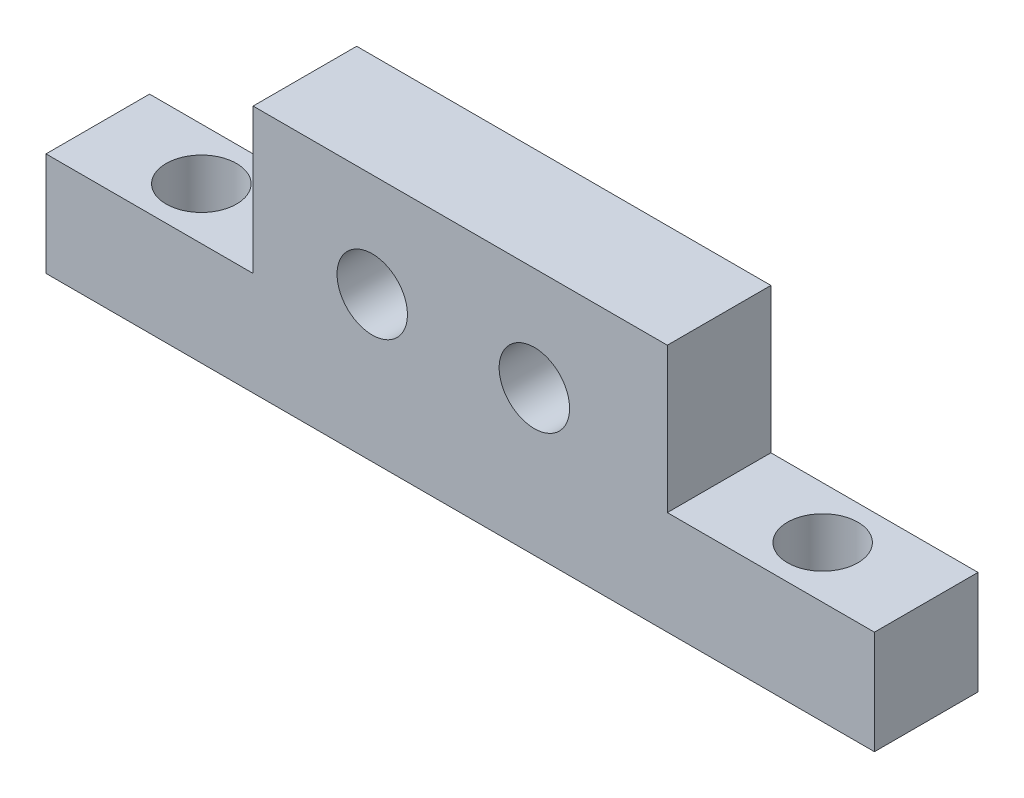
from build123d import *

# Parameters (mm, degrees)
BOSS_EXTRUDE1_DEPTH = 5
D_GAGEMENT_M31_D    = 3.4
D_GAGEMENT_M32_D    = 3.4


with BuildPart() as part:
    # Sketch1 → Boss-Extrude1 (new body)
    with BuildSketch(Plane.XY):
        Polygon((10, -3.5), (20, -3.5), (20, -8.5), (-20, -8.5), (-20, -3.5), (-10, -3.5), (-10, 3.5), (10, 3.5), align=None)
    extrude(amount=BOSS_EXTRUDE1_DEPTH)

    # Dégagement M31 (through all)
    with Locations(Plane.XY.offset(5)):
        with Locations((3.580019281, -1.5), (-4.248289546, -1.5)):
            Hole(D_GAGEMENT_M31_D / 2)

    # Dégagement M32 (through all)
    with Locations(Plane(origin=(0, -3.5, 0), x_dir=(1, 0, 0), z_dir=(0, 1, 0))):
        with Locations((-15, -2.5), (15, -2.5)):
            Hole(D_GAGEMENT_M32_D / 2)


solid = part.part
